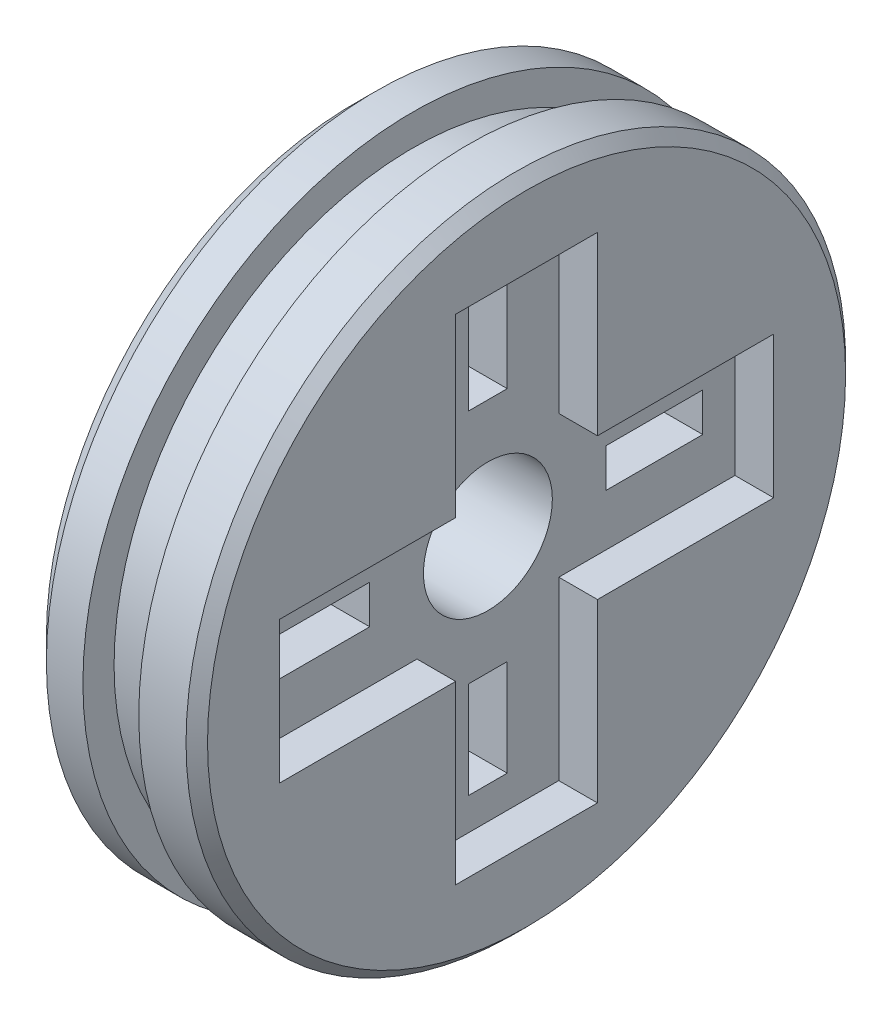
from build123d import *

# Parameters (mm, degrees)
SKETCH2_W            = 2.6
SKETCH2_H            = 2.45
BOSS_EXTRUDE1_START  = 62.7
SKETCH3_W            = 2.3
SKETCH3_H            = 23
BOSS_EXTRUDE1_DEPTH  = 6.6
BOSS_EXTRUDE2_START  = 54.5
SKETCH4_W            = 2.3
SKETCH4_H            = 6.6
BOSS_EXTRUDE2_DEPTH  = 23
BOSS_EXTRUDE3_START  = -79
SKETCH5_R            = 4.6
BOSS_EXTRUDE3_DEPTH  = 2.3
BOSS_EXTRUDE4_START  = -85.7
SKETCH6_R            = 7.1
BOSS_EXTRUDE4_DEPTH  = 1.7
BOSS_EXTRUDE5_START  = -84.1
SKETCH7_R            = 3
BOSS_EXTRUDE5_DEPTH  = 5.2
BOSS_EXTRUDE6_START  = 65.1
SKETCH8_W            = 4.1
SKETCH8_H            = 2.1
BOSS_EXTRUDE6_DEPTH  = 1.8
BOSS_EXTRUDE7_START  = 71.5
SKETCH9_W            = 4.1
SKETCH9_H            = 1.8
BOSS_EXTRUDE7_DEPTH  = 2.1
BOSS_EXTRUDE8_START  = 65.1
SKETCH10_W           = 4.1
SKETCH10_H           = 2.1
BOSS_EXTRUDE8_DEPTH  = 1.8
BOSS_EXTRUDE9_START  = 58.4
SKETCH11_W           = 4.1
SKETCH11_H           = 1.8
BOSS_EXTRUDE9_DEPTH  = 2.1
BOSS_EXTRUDE10_START = 65.1
SKETCH12_W           = 5.3
SKETCH12_H           = 2.4
BOSS_EXTRUDE10_DEPTH = 1.8
BOSS_EXTRUDE11_START = 73.6
SKETCH13_W           = 5.3
SKETCH13_H           = 1.8
BOSS_EXTRUDE11_DEPTH = 2.4
BOSS_EXTRUDE12_START = 65.1
SKETCH14_W           = 5.3
SKETCH14_H           = 2.4
BOSS_EXTRUDE12_DEPTH = 1.8
BOSS_EXTRUDE13_START = 56
SKETCH15_W           = 5.3
SKETCH15_H           = 1.8
BOSS_EXTRUDE13_DEPTH = 2.4


with BuildPart() as part:
    # Sketch1 → Revolve1 (revolve)
    with BuildSketch(Plane.XY.offset(66), mode=Mode.PRIVATE) as revolve1_sk:
        Polygon((-77.2, -65), (-85.2, -65), (-85.2, -50.65), (-84.2, -49.65), (-77.7, -49.65), (-77.2, -50.15), align=None)
    revolve(revolve1_sk.sketch.rotate(Axis((-90.2, -65, 66), (1, 0, 0)), 90), axis=Axis((-90.2, -65, 66), (1, 0, 0)))


with BuildPart() as body_2:
    # Sketch2 → Revolve2 (revolve)
    with BuildSketch(Plane.XY.offset(66), mode=Mode.PRIVATE) as revolve2_sk:
        with Locations((-81.2, -49.875)):
            Rectangle(SKETCH2_W, SKETCH2_H)
    revolve(revolve2_sk.sketch.rotate(Axis((-87.5, -65, 66), (1, 0, 0)), 90), axis=Axis((-87.5, -65, 66), (1, 0, 0)))


with BuildPart() as part_1:
    add(part.part)

    # Combine1: cut body 2
    add(body_2.part, mode=Mode.SUBTRACT)


with BuildPart() as body_2_2:
    # Sketch3 → Boss-Extrude1 (new body)
    with BuildSketch(Plane.XY.offset(BOSS_EXTRUDE1_START)):
        with Locations((-77.85, -65)):
            Rectangle(SKETCH3_W, SKETCH3_H)
    extrude(amount=BOSS_EXTRUDE1_DEPTH)


with BuildPart() as part_2:
    add(part_1.part)

    # Combine2: cut body 2 2
    add(body_2_2.part, mode=Mode.SUBTRACT)


with BuildPart() as body_2_3:
    # Sketch4 → Boss-Extrude2 (new body)
    with BuildSketch(Plane.XY.offset(BOSS_EXTRUDE2_START)):
        with Locations((-77.85, -65)):
            Rectangle(SKETCH4_W, SKETCH4_H)
    extrude(amount=BOSS_EXTRUDE2_DEPTH)


with BuildPart() as part_3:
    add(part_2.part)

    # Combine3: cut body 2 3
    add(body_2_3.part, mode=Mode.SUBTRACT)


with BuildPart() as body_2_4:
    # Sketch5 → Boss-Extrude3 (new body)
    with BuildSketch(Plane(origin=(0, 0, 0), x_dir=(0, 0, -1), z_dir=(1, 0, 0)).offset(BOSS_EXTRUDE3_START)):
        with Locations((-66, -65)):
            Circle(SKETCH5_R)
    extrude(amount=BOSS_EXTRUDE3_DEPTH)


with BuildPart() as part_4:
    add(part_3.part)

    # Combine4: cut body 2 4
    add(body_2_4.part, mode=Mode.SUBTRACT)


with BuildPart() as body_2_5:
    # Sketch6 → Boss-Extrude4 (new body)
    with BuildSketch(Plane(origin=(0, 0, 0), x_dir=(0, 0, -1), z_dir=(1, 0, 0)).offset(BOSS_EXTRUDE4_START)):
        with Locations((-66, -65)):
            Circle(SKETCH6_R)
    extrude(amount=BOSS_EXTRUDE4_DEPTH)


with BuildPart() as part_5:
    add(part_4.part)

    # Combine5: cut body 2 5
    add(body_2_5.part, mode=Mode.SUBTRACT)


with BuildPart() as body_2_6:
    # Sketch7 → Boss-Extrude5 (new body)
    with BuildSketch(Plane(origin=(0, 0, 0), x_dir=(0, 0, -1), z_dir=(1, 0, 0)).offset(BOSS_EXTRUDE5_START)):
        with Locations((-66, -65)):
            Circle(SKETCH7_R)
    extrude(amount=BOSS_EXTRUDE5_DEPTH)


with BuildPart() as part_6:
    add(part_5.part)

    # Combine6: cut body 2 6
    add(body_2_6.part, mode=Mode.SUBTRACT)


with BuildPart() as body_2_7:
    # Sketch8 → Boss-Extrude6 (new body)
    with BuildSketch(Plane.XY.offset(BOSS_EXTRUDE6_START)):
        with Locations((-80.95, -58.45)):
            Rectangle(SKETCH8_W, SKETCH8_H)
    extrude(amount=BOSS_EXTRUDE6_DEPTH)


with BuildPart() as part_7:
    add(part_6.part)

    # Combine7: cut body 2 7
    add(body_2_7.part, mode=Mode.SUBTRACT)


with BuildPart() as body_2_8:
    # Sketch9 → Boss-Extrude7 (new body)
    with BuildSketch(Plane.XY.offset(BOSS_EXTRUDE7_START)):
        with Locations((-80.95, -65)):
            Rectangle(SKETCH9_W, SKETCH9_H)
    extrude(amount=BOSS_EXTRUDE7_DEPTH)


with BuildPart() as part_8:
    add(part_7.part)

    # Combine8: cut body 2 8
    add(body_2_8.part, mode=Mode.SUBTRACT)


with BuildPart() as body_2_9:
    # Sketch10 → Boss-Extrude8 (new body)
    with BuildSketch(Plane.XY.offset(BOSS_EXTRUDE8_START)):
        with Locations((-80.95, -71.55)):
            Rectangle(SKETCH10_W, SKETCH10_H)
    extrude(amount=BOSS_EXTRUDE8_DEPTH)


with BuildPart() as part_9:
    add(part_8.part)

    # Combine9: cut body 2 9
    add(body_2_9.part, mode=Mode.SUBTRACT)


with BuildPart() as body_2_10:
    # Sketch11 → Boss-Extrude9 (new body)
    with BuildSketch(Plane.XY.offset(BOSS_EXTRUDE9_START)):
        with Locations((-80.95, -65)):
            Rectangle(SKETCH11_W, SKETCH11_H)
    extrude(amount=BOSS_EXTRUDE9_DEPTH)


with BuildPart() as part_10:
    add(part_9.part)

    # Combine10: cut body 2 10
    add(body_2_10.part, mode=Mode.SUBTRACT)


with BuildPart() as body_2_11:
    # Sketch12 → Boss-Extrude10 (new body)
    with BuildSketch(Plane.XY.offset(BOSS_EXTRUDE10_START)):
        with Locations((-81.55, -56.2)):
            Rectangle(SKETCH12_W, SKETCH12_H)
    extrude(amount=BOSS_EXTRUDE10_DEPTH)


with BuildPart() as part_11:
    add(part_10.part)

    # Combine11: cut body 2 11
    add(body_2_11.part, mode=Mode.SUBTRACT)


with BuildPart() as body_2_12:
    # Sketch13 → Boss-Extrude11 (new body)
    with BuildSketch(Plane.XY.offset(BOSS_EXTRUDE11_START)):
        with Locations((-81.55, -65)):
            Rectangle(SKETCH13_W, SKETCH13_H)
    extrude(amount=BOSS_EXTRUDE11_DEPTH)


with BuildPart() as part_12:
    add(part_11.part)

    # Combine12: cut body 2 12
    add(body_2_12.part, mode=Mode.SUBTRACT)


with BuildPart() as body_2_13:
    # Sketch14 → Boss-Extrude12 (new body)
    with BuildSketch(Plane.XY.offset(BOSS_EXTRUDE12_START)):
        with Locations((-81.55, -73.8)):
            Rectangle(SKETCH14_W, SKETCH14_H)
    extrude(amount=BOSS_EXTRUDE12_DEPTH)


with BuildPart() as part_13:
    add(part_12.part)

    # Combine13: cut body 2 13
    add(body_2_13.part, mode=Mode.SUBTRACT)


with BuildPart() as body_2_14:
    # Sketch15 → Boss-Extrude13 (new body)
    with BuildSketch(Plane.XY.offset(BOSS_EXTRUDE13_START)):
        with Locations((-81.55, -65)):
            Rectangle(SKETCH15_W, SKETCH15_H)
    extrude(amount=BOSS_EXTRUDE13_DEPTH)


with BuildPart() as part_14:
    add(part_13.part)

    # Combine14: cut body 2 14
    add(body_2_14.part, mode=Mode.SUBTRACT)


solid = part_14.part
